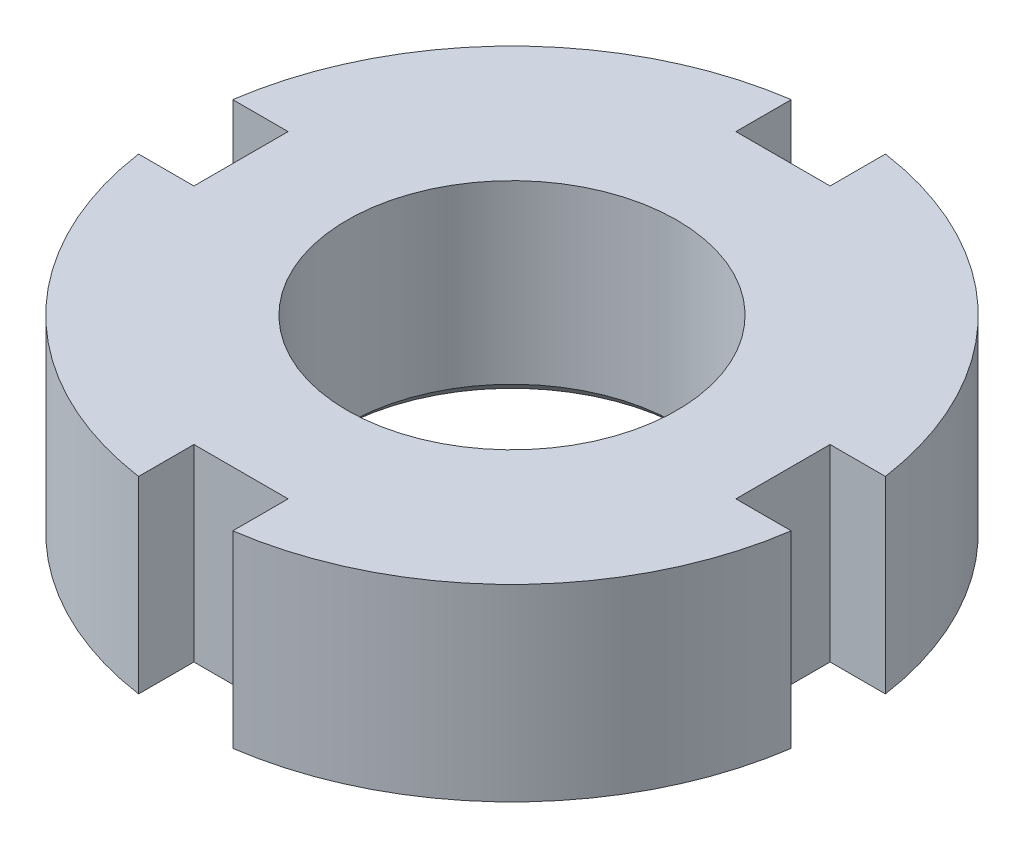
from build123d import *

# Parameters (mm, degrees)
BOSS_EXTRUDE1_DEPTH              = 8
M30X2_0_TAPPED_HOLE5_D           = 28
M30X2_0_TAPPED_HOLE5_DEPTH       = 16
M30X2_0_TAPPED_HOLE5_CSINK_D     = 30.05
M30X2_0_TAPPED_HOLE5_CSINK_ANGLE = 90
M30X2_0_TAPPED_HOLE5_TIP         = 8.412048666


with BuildPart() as part:
    # Sketch1 → Boss-Extrude1 (new, symmetric)
    with BuildSketch(Plane(origin=(0, 0, 0), x_dir=(1, 0, 0), z_dir=(0, 1, 0))):
        with BuildLine():
            Line((4, -23.012812921), (4, -27.712812921))
            ThreePointArc((4, -27.712812921), (19.798989873, -19.798989873), (27.712812921, -4))
            Line((27.712812921, -4), (23.012812921, -4))
            Line((23.012812921, -4), (23.012812921, 4))
            Line((23.012812921, 4), (27.712812921, 4))
            ThreePointArc((27.712812921, 4), (19.798989873, 19.798989873), (4, 27.712812921))
            Line((4, 27.712812921), (4, 23.012812921))
            Line((4, 23.012812921), (-4, 23.012812921))
            Line((-4, 23.012812921), (-4, 27.712812921))
            ThreePointArc((-4, 27.712812921), (-19.798989873, 19.798989873), (-27.712812921, 4))
            Line((-27.712812921, 4), (-23.012812921, 4))
            Line((-23.012812921, 4), (-23.012812921, -4))
            Line((-23.012812921, -4), (-27.712812921, -4))
            ThreePointArc((-27.712812921, -4), (-19.798989873, -19.798989873), (-4, -27.712812921))
            Line((-4, -27.712812921), (-4, -23.012812921))
            Line((-4, -23.012812921), (4, -23.012812921))
        make_face()
    extrude(amount=BOSS_EXTRUDE1_DEPTH, both=True)

    # M30x2.0 Tapped Hole5
    with Locations(Plane(origin=(0, -8, 0), x_dir=(-1, 0, 0), z_dir=(0, -1, 0))):
        with Locations((0, 0)):
            CounterSinkHole(M30X2_0_TAPPED_HOLE5_D / 2, M30X2_0_TAPPED_HOLE5_CSINK_D / 2, depth=M30X2_0_TAPPED_HOLE5_DEPTH, counter_sink_angle=M30X2_0_TAPPED_HOLE5_CSINK_ANGLE)
            with Locations((0, 0, -(M30X2_0_TAPPED_HOLE5_DEPTH + M30X2_0_TAPPED_HOLE5_TIP / 2))):  # 118° drill point
                Cone(0, M30X2_0_TAPPED_HOLE5_D / 2, M30X2_0_TAPPED_HOLE5_TIP, mode=Mode.SUBTRACT)


solid = part.part
